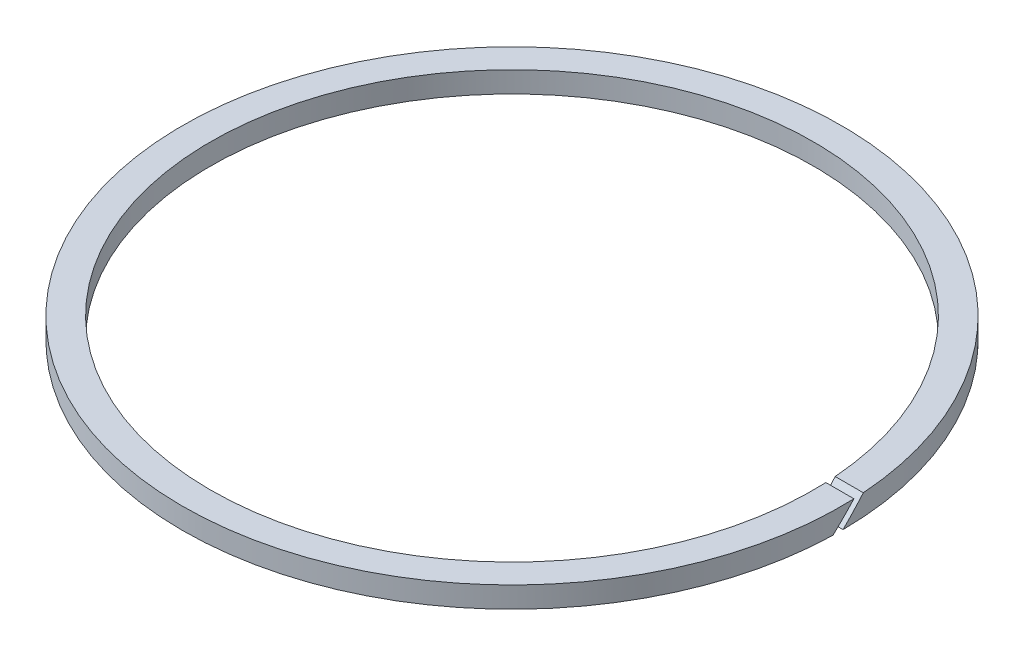
from build123d import *

# Parameters (mm, degrees)
SKETCH1_R           = 47
SKETCH1_R_2         = 43
BOSS_EXTRUDE1_DEPTH = 1.5
CUT_EXTRUDE1_DEPTH  = 67.484960705


with BuildPart() as part:
    # Sketch1 → Boss-Extrude1 (new, symmetric)
    with BuildSketch(Plane(origin=(0, 0, 0), x_dir=(1, 0, 0), z_dir=(0, 1, 0))):
        with Locations(Location((0, 0, 0), (0, 0, 270))):
            Circle(SKETCH1_R)
        with Locations(Location((0, 0, 0), (0, 0, 270))):
            Circle(SKETCH1_R_2, mode=Mode.SUBTRACT)
    extrude(amount=BOSS_EXTRUDE1_DEPTH, both=True)

    # Sketch2 → Cut-Extrude1 (cut, through all)
    with BuildSketch(Plane(origin=(0, 0, 0), x_dir=(0, 0, -1), z_dir=(1, 0, 0))):
        Polygon((4.499695473, 4.206802254), (-3.206802254, -3.499695473), (-2.499695473, -4.206802254), (5.206802254, 3.499695473), align=None)
    extrude(amount=CUT_EXTRUDE1_DEPTH, mode=Mode.SUBTRACT)


solid = part.part
